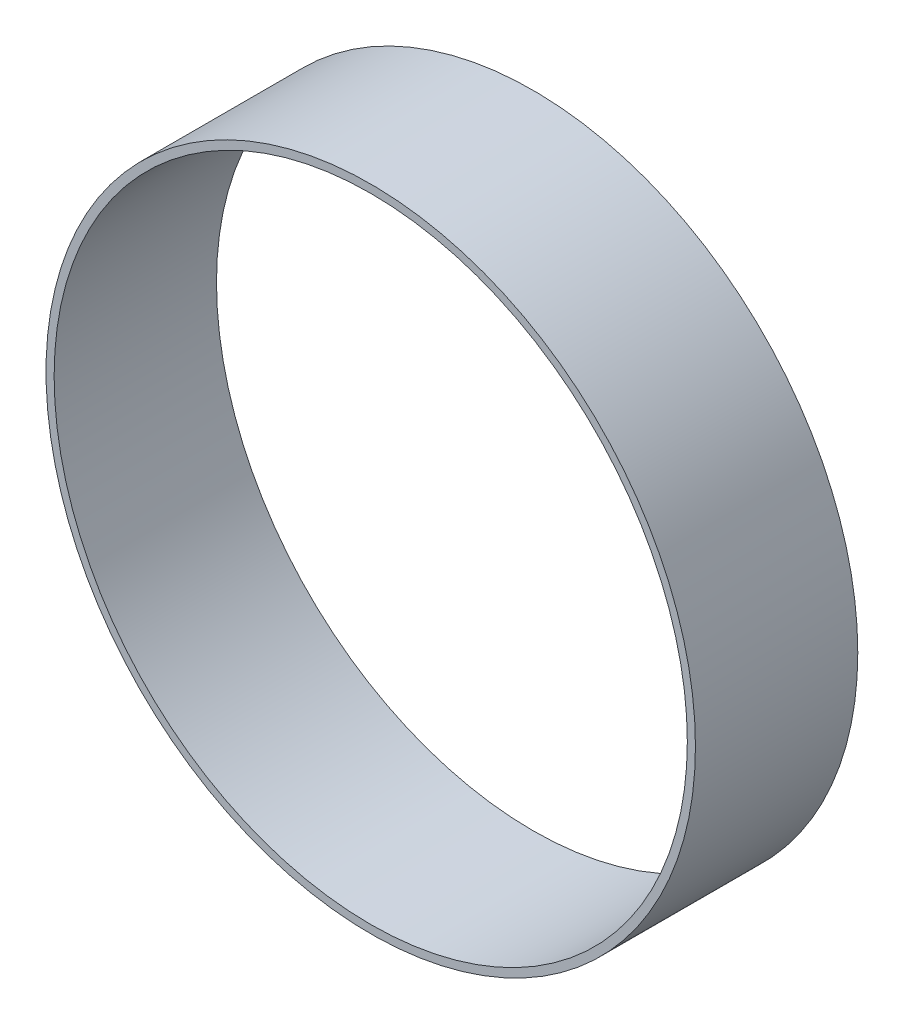
from build123d import *

# Parameters (mm, degrees)
SKETCH1_R           = 50.8
SKETCH1_R_2         = 49.53
BOSS_EXTRUDE1_DEPTH = 25.4


with BuildPart() as part:
    # Sketch1 → Boss-Extrude1 (new body)
    with BuildSketch(Plane.XY):
        Circle(SKETCH1_R)
        Circle(SKETCH1_R_2, mode=Mode.SUBTRACT)
    extrude(amount=BOSS_EXTRUDE1_DEPTH)


solid = part.part
